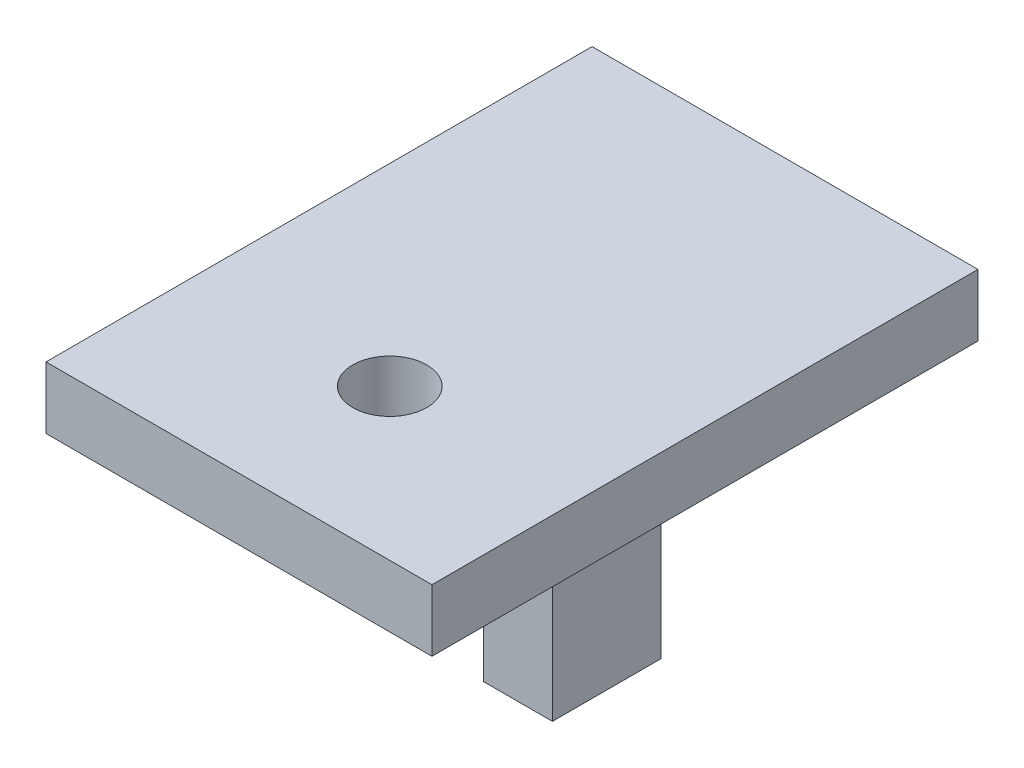
from build123d import *

# Parameters (mm, degrees)
SKETCH1_W           = 62.2
SKETCH1_H           = 88.01
BOSS_EXTRUDE1_DEPTH = 10
SKETCH2_R           = 5.969
CUT_EXTRUDE1_DEPTH  = 10
SKETCH3_W           = 11.09
SKETCH3_H           = 17.48264
BOSS_EXTRUDE2_DEPTH = 69.9


with BuildPart() as part:
    # Sketch1 → Boss-Extrude1 (new body)
    with BuildSketch(Plane(origin=(0, 0, 0), x_dir=(1, 0, 0), z_dir=(0, 1, 0))):
        with Locations((0, -3.512935)):
            Rectangle(SKETCH1_W, SKETCH1_H)
    extrude(amount=BOSS_EXTRUDE1_DEPTH)

    # Sketch2 → Cut-Extrude1 (cut)
    with BuildSketch(Plane(origin=(0, 10, 0), x_dir=(1, 0, 0), z_dir=(0, 1, 0))):
        with Locations(Location((0, -23.217935, 0), (0, 0, 270))):
            Circle(SKETCH2_R)
    extrude(amount=-CUT_EXTRUDE1_DEPTH, mode=Mode.SUBTRACT)

    # Sketch3 → Boss-Extrude2 (add)
    with BuildSketch(Plane.XZ):
        with Locations((-25.555, -31.750745)):
            Rectangle(SKETCH3_W, SKETCH3_H)
    extrude(amount=BOSS_EXTRUDE2_DEPTH)


solid = part.part
